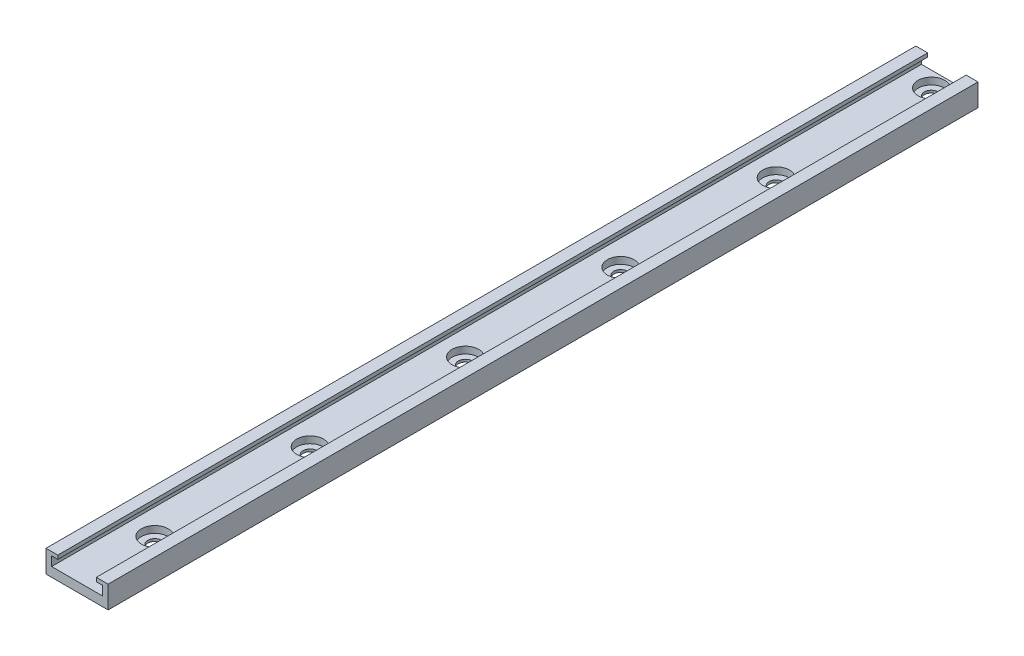
from build123d import *

# Parameters (mm, degrees)
EXTRUDE_2_DEPTH              = 280
HOLE_WIZARD_M4_1_D           = 4.5
HOLE_WIZARD_M4_1_CBORE_D     = 8.6
HOLE_WIZARD_M4_1_CBORE_DEPTH = 2.2
HOLE_WIZARD_M4_3_D           = 4.5
HOLE_WIZARD_M4_3_CBORE_D     = 8.6
HOLE_WIZARD_M4_3_CBORE_DEPTH = 2.2


with BuildPart() as part:
    # ｽｹｯﾁ1 → ﾎﾞｽ - 押し出し2 (new body)
    with BuildSketch(Plane.XY):
        Polygon((0, 0), (20, 0), (20, 7.2), (16.2, 7.2), (16.2, 5.969681415), (18.2, 5.969681415), (18.2, 3), (1.8, 3), (1.8, 6), (3.8, 6), (3.8, 7.2), (0, 7.2), align=None)
    extrude(amount=EXTRUDE_2_DEPTH)

    # M4 丸押えねじ用座ぐり穴1 (through all)
    with Locations(Plane(origin=(0, 3, 0), x_dir=(1, 0, 0), z_dir=(0, 1, 0))):
        with Locations((10, -255), (10, -205), (10, -155), (10, -105), (10, -55)):
            CounterBoreHole(HOLE_WIZARD_M4_1_D / 2, HOLE_WIZARD_M4_1_CBORE_D / 2, HOLE_WIZARD_M4_1_CBORE_DEPTH)

    # M4 丸押えねじ用座ぐり穴3 (through all)
    with Locations(Plane(origin=(0, 3, 0), x_dir=(1, 0, 0), z_dir=(0, 1, 0))):
        with Locations((10, -5)):
            CounterBoreHole(HOLE_WIZARD_M4_3_D / 2, HOLE_WIZARD_M4_3_CBORE_D / 2, HOLE_WIZARD_M4_3_CBORE_DEPTH)


solid = part.part
